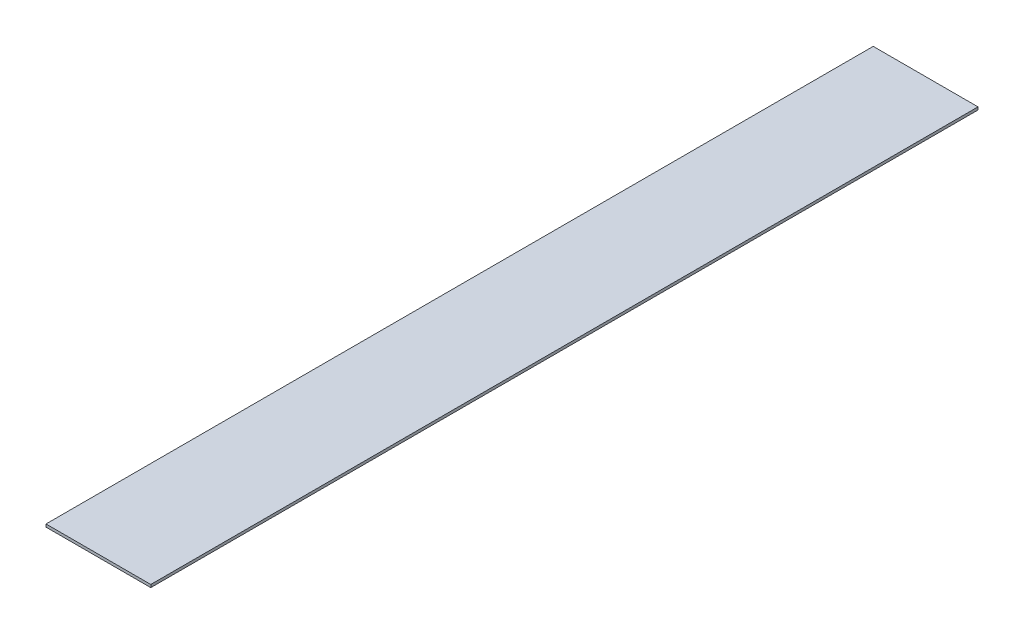
from build123d import *

# Parameters (mm, degrees)
ESBO_O1_W                = 19
ESBO_O1_H                = 0.5
RESSALTO_EXTRUS_O1_DEPTH = 150


with BuildPart() as part:
    # Esboço1 → Ressalto-extrusão1 (new body)
    with BuildSketch(Plane.XY):
        with Locations((9.5, 0.25)):
            Rectangle(ESBO_O1_W, ESBO_O1_H)
    extrude(amount=RESSALTO_EXTRUS_O1_DEPTH)


solid = part.part
